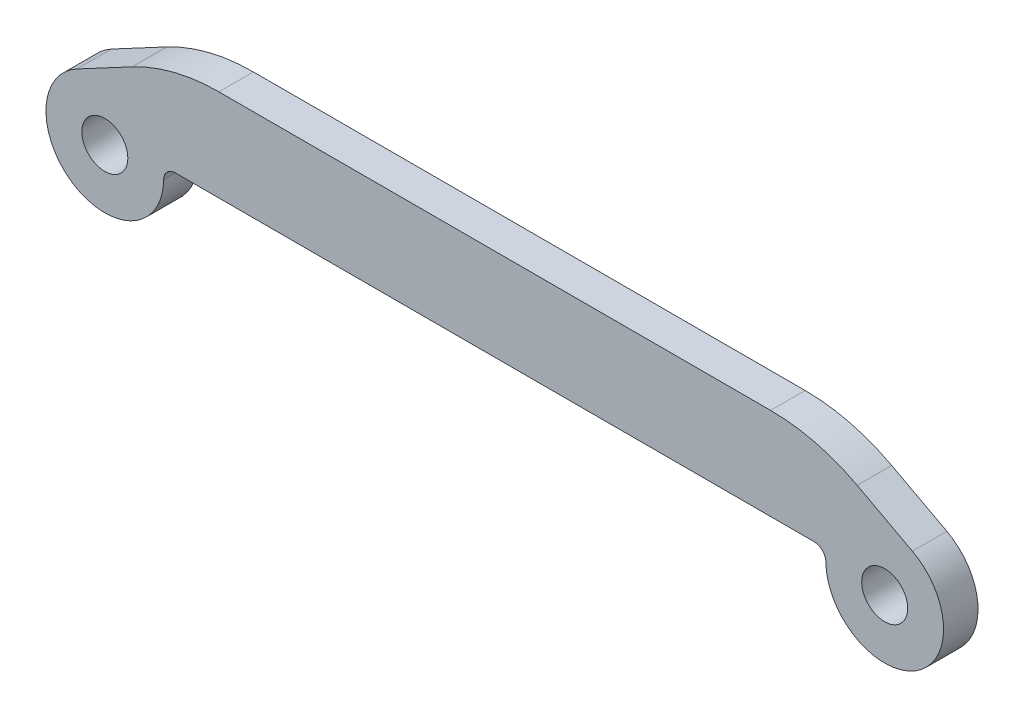
from build123d import *

# Parameters (mm, degrees)
SKETCH1_R           = 0.0625
BOSS_EXTRUDE1_DEPTH = 0.046875
FILLET1_R           = 0.5
FILLET2_R           = 0.032


with BuildPart() as part:
    # Sketch1 → Boss-Extrude1 (new, symmetric)
    with BuildSketch(Plane.XY):
        with BuildLine():
            Line((0.875, 0), (-0.875, 0))
            Line((-0.875, 0), (-1.135294118, -0.138823529))
            ThreePointArc((-1.135294118, -0.138823529), (-1.142319321, -0.417198868), (-0.9, -0.28))
            Line((-0.9, -0.28), (-0.9, -0.25))
            Line((-0.9, -0.25), (0.9, -0.25))
            Line((0.9, -0.25), (0.9, -0.28))
            ThreePointArc((0.9, -0.28), (1.142319321, -0.417198868), (1.135294118, -0.138823529))
            Line((1.135294118, -0.138823529), (0.875, 0))
        make_face()
        with Locations((-1.06, -0.28)):
            Circle(SKETCH1_R, mode=Mode.SUBTRACT)
        with Locations(Location((1.06, -0.28, 0), (0, 0, 180))):
            Circle(SKETCH1_R, mode=Mode.SUBTRACT)
    extrude(amount=BOSS_EXTRUDE1_DEPTH, both=True)

    # Fillet1
    fillet1_edges = [part.edges().sort_by_distance(p)[0] for p in [
        (-0.875, 0, 0),
        (0.875, 0, 0),
    ]]
    fillet(fillet1_edges, radius=FILLET1_R)

    # Fillet2
    fillet2_edges = [part.edges().sort_by_distance(p)[0] for p in [
        (0.9, -0.25, 0),
        (-0.9, -0.25, 0),
    ]]
    fillet(fillet2_edges, radius=FILLET2_R)


solid = part.part
